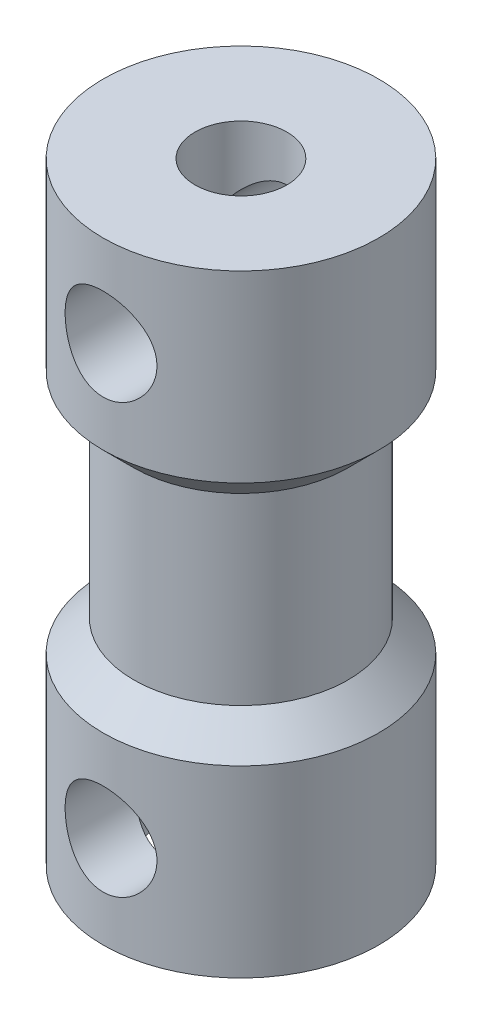
from build123d import *

# Parameters (mm, degrees)
SKETCH2_R               = 1.5
CUT_EXTRUDE1_DEPTH      = 21.988091862
SKETCH3_R               = 2.5
CUT_EXTRUDE2_DEPTH      = 10
CUT_EXTRUDE3_DEPTH      = 12.853269591
CUT_EXTRUDE3_DEPTH_BACK = 12.853269591
SKETCH4_R               = 1.5


with BuildPart() as part:
    # Sketch1 → Revolve1 (revolve)
    with BuildSketch(Plane.XY, mode=Mode.PRIVATE) as revolve1_sk:
        Polygon((3.5, -3), (3.5, 3), (4.5, 4), (4.5, 10), (0, 10), (0, -10), (4.5, -10), (4.5, -4), align=None)
    revolve(revolve1_sk.sketch.rotate(Axis((0, 10, 0), (0, -1, 0)), 90), axis=Axis((0, 10, 0), (0, -1, 0)))

    # Sketch2 → Cut-Extrude1 (cut, through all)
    with BuildSketch(Plane(origin=(0, 10, 0), x_dir=(1, 0, 0), z_dir=(0, 1, 0))):
        with Locations(Location((0, 0, 0), (0, 0, 270))):
            Circle(SKETCH2_R)
    extrude(amount=-CUT_EXTRUDE1_DEPTH, mode=Mode.SUBTRACT)

    # Sketch3 → Cut-Extrude2 (cut)
    with BuildSketch(Plane.XZ.offset(10)):
        with Locations(Location((0, 0, 0), (0, 0, 270))):
            Circle(SKETCH3_R)
    extrude(amount=-CUT_EXTRUDE2_DEPTH, mode=Mode.SUBTRACT)

    # Sketch4 → Cut-Extrude3 (cut, two sides: drawn at the far end of the back side and taken through both)
    with BuildSketch(Plane.XY.offset(-CUT_EXTRUDE3_DEPTH_BACK)):
        with Locations((0, 7)):
            Circle(SKETCH4_R)
        with Locations((0, -7)):
            Circle(SKETCH4_R)
    extrude(amount=CUT_EXTRUDE3_DEPTH + CUT_EXTRUDE3_DEPTH_BACK, mode=Mode.SUBTRACT)


solid = part.part
